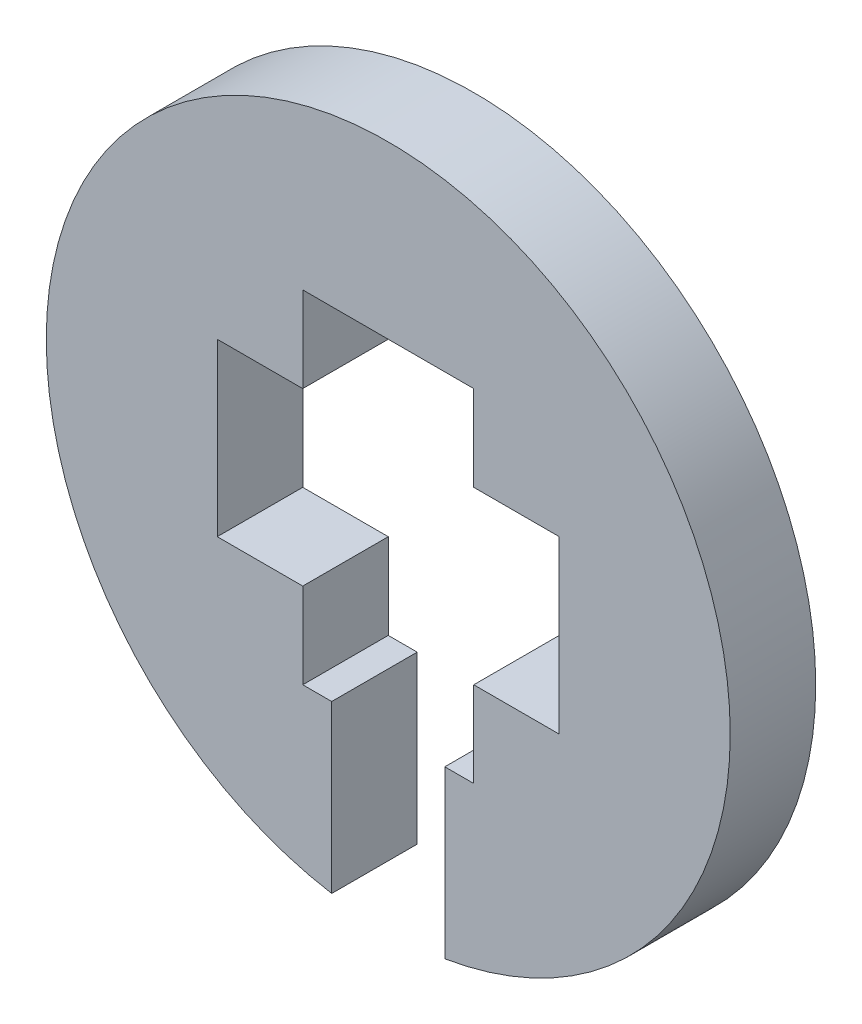
from build123d import *

# Parameters (mm, degrees)
SKETCH1_R           = 6.35
BOSS_EXTRUDE1_DEPTH = 1.5875
SKETCH2_W           = 2.1
SKETCH2_H           = 3.175
CUT_EXTRUDE1_DEPTH  = 10.119493201


with BuildPart() as part:
    # Sketch1 → Boss-Extrude1 (new body)
    with BuildSketch(Plane.XY):
        Circle(SKETCH1_R)
        Polygon((-3.175, -1.5875), (-3.175, 1.5875), (-1.5875, 1.5875), (-1.5875, 3.175), (1.5875, 3.175), (1.5875, 1.5875), (3.175, 1.5875), (3.175, -1.5875), (1.5875, -1.5875), (1.5875, -3.175), (-1.5875, -3.175), (-1.5875, -1.5875), align=None, mode=Mode.SUBTRACT)
    extrude(amount=BOSS_EXTRUDE1_DEPTH)

    # Sketch2 → Cut-Extrude1 (cut, through all)
    with BuildSketch(Plane(origin=(0, 0, 0), x_dir=(-1, 0, 0), z_dir=(0, 0, -1))):
        with Locations((0, -4.7625)):
            Rectangle(SKETCH2_W, SKETCH2_H)
    extrude(amount=-CUT_EXTRUDE1_DEPTH, mode=Mode.SUBTRACT)


solid = part.part
